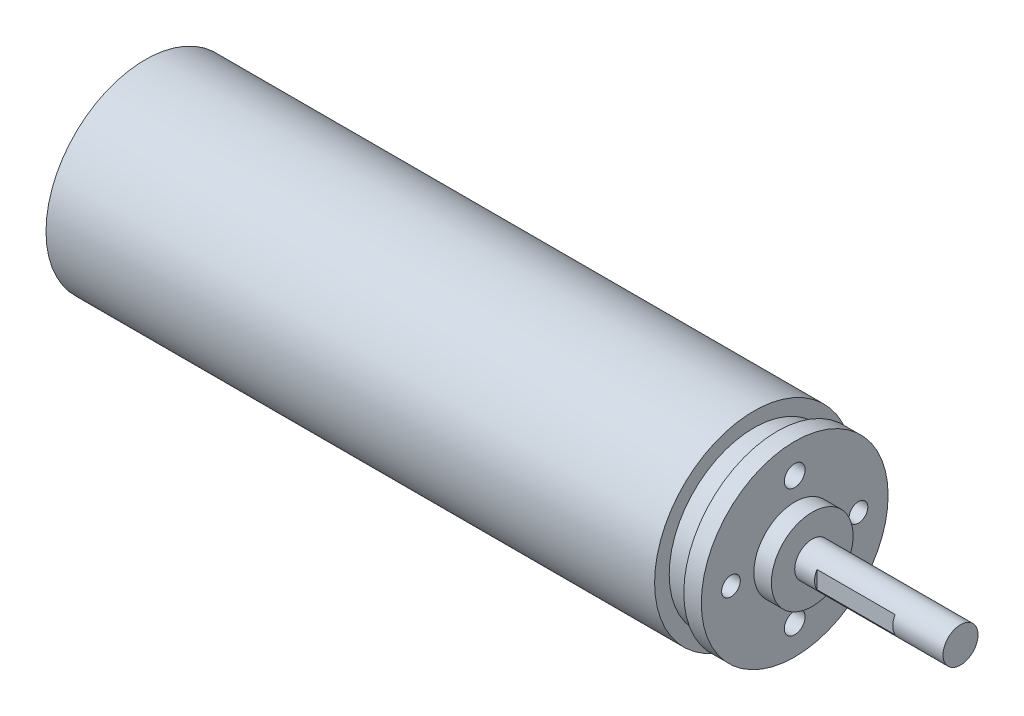
from build123d import *

# Parameters (mm, degrees)
CUT_EXTRUDE1_DEPTH        = 2.54
CUT_EXTRUDE1_DEPTH_BACK   = 2.54
SKETCH4_W                 = 6.7
SKETCH4_H                 = 0.2
F_2_56_TAPPED_HOLE1_D     = 1.778
F_2_56_TAPPED_HOLE1_DEPTH = 6.604
F_2_56_TAPPED_HOLE1_TIP   = 0.53416509
M2X0_4_TAPPED_HOLE1_D     = 1.6
M2X0_4_TAPPED_HOLE1_DEPTH = 6.096
M2X0_4_TAPPED_HOLE1_TIP   = 0.480688495
SKETCH10_R                = 8.5
BOSS_EXTRUDE2_DEPTH       = 23.622


with BuildPart() as part:
    # Sketch3 → Revolve1 (revolve)
    with BuildSketch(Plane.XY):
        Polygon((0, -8.5), (28.5, -8.5), (28.5, -7.25), (30.5, -7.25), (30.5, -8), (32, -8), (32, -3.5), (33.5, -3.5), (33.5, -1.5), (40.888216755, -1.5), (41.661571645, -1.5), (46.2, -1.5), (46.2, 0), (0, 0), align=None)
    revolve(axis=Axis((0, 0, 0), (1, 0, 0)))

    # Sketch4 → Cut-Extrude1 (cut, two sides: drawn at the far end of the back side and taken through both)
    with BuildSketch(Plane(origin=(0, 0, 0), x_dir=(1, 0, 0), z_dir=(0, 1, 0)).offset(-CUT_EXTRUDE1_DEPTH_BACK)):
        with Locations((38.55, -1.4)):
            Rectangle(SKETCH4_W, SKETCH4_H)
    extrude(amount=CUT_EXTRUDE1_DEPTH + CUT_EXTRUDE1_DEPTH_BACK, mode=Mode.SUBTRACT)

    # #2-56 Tapped Hole1
    with Locations(Plane(origin=(32, 0, 0), x_dir=(0, 0, -1), z_dir=(1, 0, 0))):
        with Locations((0, 5.46), (0, -5.46)):
            Hole(F_2_56_TAPPED_HOLE1_D / 2, depth=F_2_56_TAPPED_HOLE1_DEPTH)
            with Locations((0, 0, -(F_2_56_TAPPED_HOLE1_DEPTH + F_2_56_TAPPED_HOLE1_TIP / 2))):  # 118° drill point
                Cone(0, F_2_56_TAPPED_HOLE1_D / 2, F_2_56_TAPPED_HOLE1_TIP, mode=Mode.SUBTRACT)

    # M2x0.4 Tapped Hole1
    with Locations(Plane(origin=(32, 0, 0), x_dir=(0, 0, -1), z_dir=(1, 0, 0))):
        with Locations((-5.46, 0), (5.46, 0)):
            Hole(M2X0_4_TAPPED_HOLE1_D / 2, depth=M2X0_4_TAPPED_HOLE1_DEPTH)
            with Locations((0, 0, -(M2X0_4_TAPPED_HOLE1_DEPTH + M2X0_4_TAPPED_HOLE1_TIP / 2))):  # 118° drill point
                Cone(0, M2X0_4_TAPPED_HOLE1_D / 2, M2X0_4_TAPPED_HOLE1_TIP, mode=Mode.SUBTRACT)

    # Sketch10 → Boss-Extrude2 (add)
    with BuildSketch(Plane.ZY):
        Circle(SKETCH10_R)
    extrude(amount=BOSS_EXTRUDE2_DEPTH)


solid = part.part
